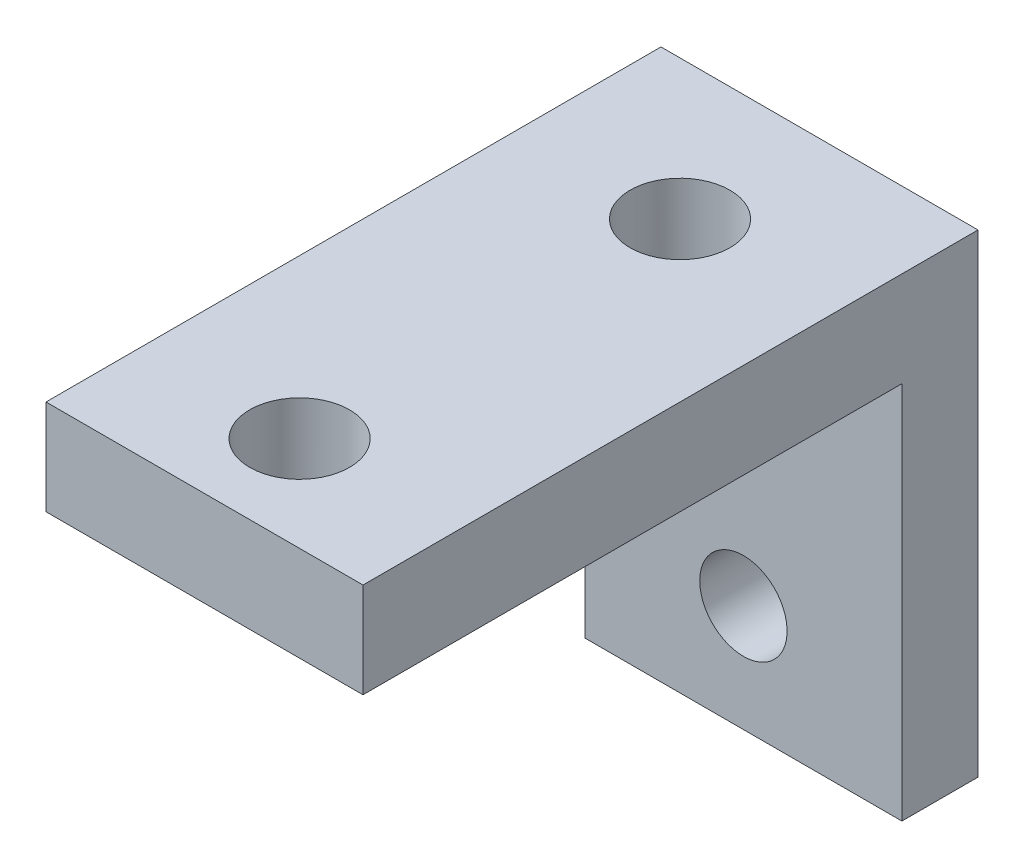
from build123d import *

# Parameters (mm, degrees)
SKETCH1_W           = 12.7
SKETCH1_H           = 18.986000128
SKETCH1_R           = 1.75
BOSS_EXTRUDE1_DEPTH = 3.048
SKETCH3_W           = 21.59
SKETCH3_H           = 3.81
BOSS_EXTRUDE2_DEPTH = 12.7
SKETCH4_R           = 2
CUT_EXTRUDE1_DEPTH  = 32.746208354


with BuildPart() as part:
    # Sketch1 → Boss-Extrude1 (new body)
    with BuildSketch(Plane.XY):
        Rectangle(SKETCH1_W, SKETCH1_H)
        with Locations(Location((0, -5.203000064, 0), (0, 0, 180))):
            Circle(SKETCH1_R, mode=Mode.SUBTRACT)
    extrude(amount=BOSS_EXTRUDE1_DEPTH)

    # Sketch3 → Boss-Extrude2 (add, through all)
    with BuildSketch(Plane(origin=(6.35, 0, 0), x_dir=(0, 0, -1), z_dir=(1, 0, 0))):
        with Locations((-13.843, 7.588000064)):
            Rectangle(SKETCH3_W, SKETCH3_H)
    extrude(amount=-BOSS_EXTRUDE2_DEPTH)

    # Sketch4 → Cut-Extrude1 (cut, through all)
    with BuildSketch(Plane(origin=(0, 9.493000064, 0), x_dir=(1, 0, 0), z_dir=(0, 1, 0))):
        with Locations(Location((0, -20.828, 0), (0, 0, 270))):
            Circle(SKETCH4_R)
        with Locations((0, -5.588)):
            Circle(SKETCH4_R)
    extrude(amount=-CUT_EXTRUDE1_DEPTH, mode=Mode.SUBTRACT)


solid = part.part
